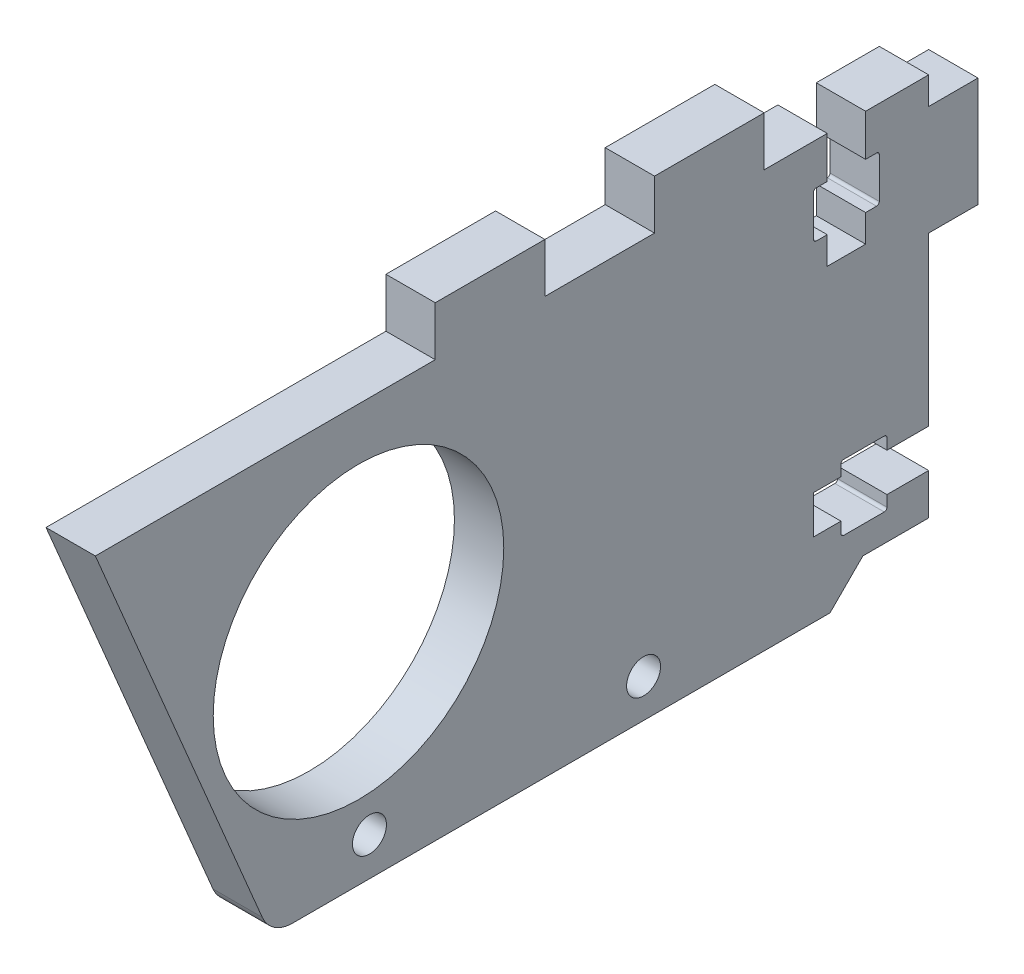
from build123d import *

# Parameters (mm, degrees)
BOSS_EXTRUDE1_DEPTH  = 4.5
SKETCH2_W            = 9
SKETCH2_H            = 10
BOSS_EXTRUDE2_DEPTH  = 4.5
BOSS_EXTRUDE3_DEPTH  = 4.5
CUT_EXTRUDE1_DEPTH   = 84.792899461
SKETCH5_W            = 10
SKETCH5_H            = 4.5
BOSS_EXTRUDE4_DEPTH  = 4.5
CUT_EXTRUDE4_DEPTH   = 84.792899461
BOSS_EXTRUDE11_DEPTH = 4.5
SKETCH21_R           = 1.55
CUT_EXTRUDE8_DEPTH   = 86.089658596
SKETCH22_R           = 13.25
CUT_EXTRUDE9_DEPTH   = 86.089658596


with BuildPart() as part:
    # Sketch1 → Boss-Extrude1 (new body)
    with BuildSketch(Plane(origin=(0, 0, 0), x_dir=(0, 0, -1), z_dir=(1, 0, 0))):
        Polygon((0, 0), (0, -35), (-76, 0), align=None)
    extrude(amount=BOSS_EXTRUDE1_DEPTH)

    # Sketch2 → Boss-Extrude2 (add, through all)
    with BuildSketch(Plane(origin=(4.5, 0, 0), x_dir=(0, 0, -1), z_dir=(1, 0, 0))):
        with Locations((0, -7.5)):
            Rectangle(SKETCH2_W, SKETCH2_H)
    extrude(amount=-BOSS_EXTRUDE2_DEPTH)

    # Sketch3 → Boss-Extrude3 (add, through all)
    with BuildSketch(Plane(origin=(4.5, 0, 0), x_dir=(0, 0, -1), z_dir=(1, 0, 0))):
        Polygon((0, -35), (-40, -35), (-76, 0), (0, -25), align=None)
    extrude(amount=-BOSS_EXTRUDE3_DEPTH)

    # Sketch4 → Cut-Extrude1 (cut, through all)
    with BuildSketch(Plane(origin=(4.5, 0, 0), x_dir=(0, 0, -1), z_dir=(1, 0, 0))):
        with BuildLine():
            Line((0, -31.25), (0, -27.75))
            Line((0, -27.75), (-3.8, -27.75))
            Line((-3.8, -27.75), (-3.8, -26.75))
            ThreePointArc((-3.8, -26.75), (-3.873223305, -26.573223305), (-4.05, -26.5))
            Line((-4.05, -26.5), (-7.75, -26.5))
            ThreePointArc((-7.75, -26.5), (-7.926776695, -26.573223305), (-8, -26.75))
            Line((-8, -26.75), (-8, -27.75))
            Line((-8, -27.75), (-10.5, -27.75))
            Line((-10.5, -27.75), (-10.5, -31.25))
            Line((-10.5, -31.25), (-8, -31.25))
            Line((-8, -31.25), (-8, -32.25))
            ThreePointArc((-8, -32.25), (-7.926776695, -32.426776695), (-7.75, -32.5))
            Line((-7.75, -32.5), (-4.05, -32.5))
            ThreePointArc((-4.05, -32.5), (-3.873223305, -32.426776695), (-3.8, -32.25))
            Line((-3.8, -32.25), (-3.8, -31.25))
            Line((-3.8, -31.25), (0, -31.25))
        make_face()
    extrude(amount=-CUT_EXTRUDE1_DEPTH, mode=Mode.SUBTRACT)

    # Sketch5 → Boss-Extrude4 (add, through all)
    with BuildSketch(Plane(origin=(4.5, 0, 0), x_dir=(0, 0, -1), z_dir=(1, 0, 0))):
        with Locations((-20, 2.25)):
            Rectangle(SKETCH5_W, SKETCH5_H)
        with Locations((-40, 2.25)):
            Rectangle(SKETCH5_W, SKETCH5_H)
    extrude(amount=-BOSS_EXTRUDE4_DEPTH)

    # Sketch11 → Cut-Extrude4 (cut, through all)
    with BuildSketch(Plane.ZY):
        with BuildLine():
            Line((5.75, -10.5), (9.25, -10.5))
            Line((9.25, -10.5), (9.25, -8))
            Line((9.25, -8), (10.25, -8))
            ThreePointArc((10.25, -8), (10.426776695, -7.926776695), (10.5, -7.75))
            Line((10.5, -7.75), (10.5, -4.05))
            ThreePointArc((10.5, -4.05), (10.426776695, -3.873223305), (10.25, -3.8))
            Line((10.25, -3.8), (9.25, -3.8))
            Line((9.25, -3.8), (9.25, 0))
            Line((9.25, 0), (5.75, 0))
            Line((5.75, 0), (5.75, -3.8))
            Line((5.75, -3.8), (4.75, -3.8))
            ThreePointArc((4.75, -3.8), (4.573223305, -3.873223305), (4.5, -4.05))
            Line((4.5, -4.05), (4.5, -7.75))
            ThreePointArc((4.5, -7.75), (4.573223305, -7.926776695), (4.75, -8))
            Line((4.75, -8), (5.75, -8))
            Line((5.75, -8), (5.75, -10.5))
        make_face()
    extrude(amount=-CUT_EXTRUDE4_DEPTH, mode=Mode.SUBTRACT)

    # Sketch20 → Boss-Extrude11 (add, through all)
    with BuildSketch(Plane(origin=(4.5, 0, 0), x_dir=(0, 0, -1), z_dir=(1, 0, 0))):
        with BuildLine():
            Line((-9, -38), (-58.008074506, -38))
            ThreePointArc((-58.008074506, -38), (-59.667515225, -37.499251188), (-60.772980632, -36.164171))
            Line((-60.772980632, -36.164171), (-76, 0))
            Line((-76, 0), (-40, -35))
            Line((-40, -35), (-6, -35))
            Line((-6, -35), (-9, -38))
        make_face()
    extrude(amount=-BOSS_EXTRUDE11_DEPTH)

    # Sketch21 → Cut-Extrude8 (cut, through all)
    with BuildSketch(Plane(origin=(4.5, 0, 0), x_dir=(0, 0, -1), z_dir=(1, 0, 0))):
        with Locations((-51, -34.5)):
            Circle(SKETCH21_R)
        with Locations((-26, -34.5)):
            Circle(SKETCH21_R)
    extrude(amount=-CUT_EXTRUDE8_DEPTH, mode=Mode.SUBTRACT)

    # Sketch22 → Cut-Extrude9 (cut, through all)
    with BuildSketch(Plane(origin=(4.5, 0, 0), x_dir=(0, 0, -1), z_dir=(1, 0, 0))):
        with Locations((-52, -18)):
            Circle(SKETCH22_R)
    extrude(amount=-CUT_EXTRUDE9_DEPTH, mode=Mode.SUBTRACT)


solid = part.part
